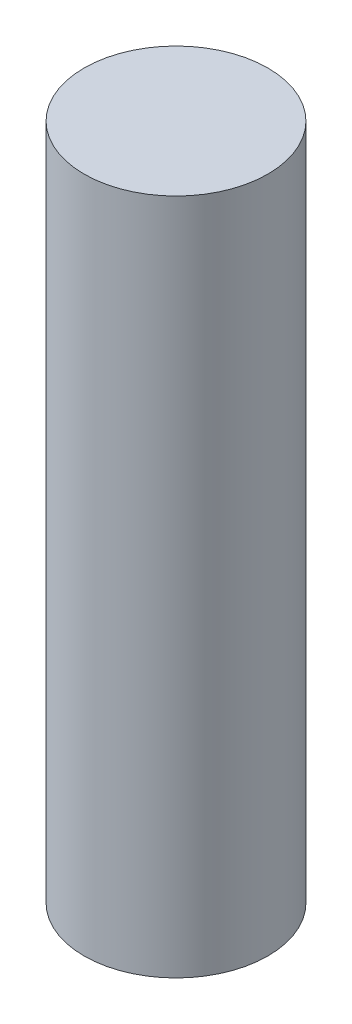
from build123d import *

# Parameters (mm, degrees)
SKETCH_1_R      = 1.85
EXTRUDE_1_DEPTH = 13
SKETCH_2_R      = 1.9
EXTRUDE_2_DEPTH = 14


with BuildPart() as part:
    # 草图1 → 凸台-拉伸1 (new body)
    with BuildSketch(Plane(origin=(0, 0, 0), x_dir=(1, 0, 0), z_dir=(0, 1, 0))):
        with Locations(Location((0, 0, 0), (0, 0, 90))):
            Circle(SKETCH_1_R)
    extrude(amount=EXTRUDE_1_DEPTH)

    # 草图2 → 凸台-拉伸2 (add)
    with BuildSketch(Plane(origin=(0, 13, 0), x_dir=(1, 0, 0), z_dir=(0, 1, 0))):
        with Locations(Location((0, 0, 0), (0, 0, 270))):
            Circle(SKETCH_2_R)
    extrude(amount=-EXTRUDE_2_DEPTH)


solid = part.part
